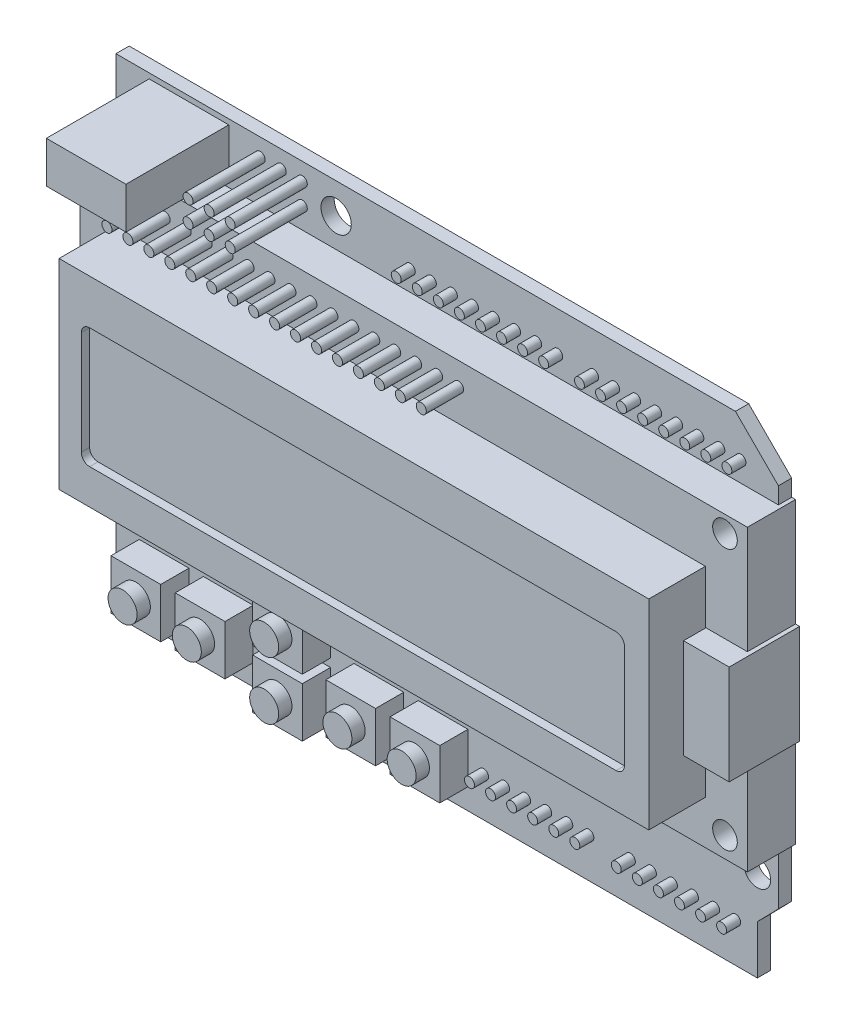
from build123d import *

# Parameters (mm, degrees)
SKETCH2_W            = 71.12
SKETCH2_H            = 24.13
BOSS_EXTRUDE1_DEPTH  = 12.63
SKETCH3_W            = 80.5
SKETCH3_H            = 36
SKETCH3_R            = 1.4859
BOSS_EXTRUDE2_DEPTH  = 5.8
SKETCH4_R            = 1.8288
SKETCH4_R_2          = 1.6
SKETCH4_R_3          = 1.4859
BOSS_EXTRUDE4_DEPTH  = 1.6
SKETCH5_R            = 1.75
BOSS_EXTRUDE5_DEPTH  = 6.6
SKETCH6_W            = 6
SKETCH6_H            = 6
BOSS_EXTRUDE6_DEPTH  = 5
SKETCH7_W            = 9.6
SKETCH7_H            = 5
BOSS_EXTRUDE7_DEPTH  = 14
SKETCH8_R            = 0.607588519
BOSS_EXTRUDE8_DEPTH  = 10.3
SKETCH9_R            = 0.6
BOSS_EXTRUDE9_DEPTH  = 3.3
SKETCH10_R           = 0.6
BOSS_EXTRUDE10_DEPTH = 10.3
SKETCH11_W           = 5.5
SKETCH11_H           = 12
BOSS_EXTRUDE11_DEPTH = 8.5
CUT_EXTRUDE1_DEPTH   = 1


with BuildPart() as part:
    # Sketch2 → Boss-Extrude1 (new body)
    with BuildSketch(Plane.XY):
        with Locations((39.392131734, 32.008259463)):
            Rectangle(SKETCH2_W, SKETCH2_H)
    extrude(amount=BOSS_EXTRUDE1_DEPTH)

    # Sketch3 → Boss-Extrude2 (add)
    with BuildSketch(Plane.XY):
        with Locations((39.764131734, 32.677259463)):
            Rectangle(SKETCH3_W, SKETCH3_H)
        with Locations((1.524412377, 48.661369793)):
            Circle(SKETCH3_R, mode=Mode.SUBTRACT)
        with Locations((1.524412377, 17.153759759)):
            Circle(SKETCH3_R, mode=Mode.SUBTRACT)
        with Locations((77.309031734, 17.153759463)):
            Circle(SKETCH3_R, mode=Mode.SUBTRACT)
        with Locations((77.309031734, 48.661369497)):
            Circle(SKETCH3_R, mode=Mode.SUBTRACT)
    extrude(amount=BOSS_EXTRUDE2_DEPTH)

    # Sketch4 → Boss-Extrude4 (add)
    with BuildSketch(Plane.XY):
        Polygon((-0.342397773, 57.8612), (74.3712, 57.8612), (79.5528, 52.6796), (79.5528, 8.4836), (77.0128, 5.880101811), (77.0128, 0), (-0.342397773, 0), align=None)
        with Locations((26.2128, 54.2036)):
            Circle(SKETCH4_R, mode=Mode.SUBTRACT)
        with Locations((77.0128, 11.0236)):
            Circle(SKETCH4_R_2, mode=Mode.SUBTRACT)
        with Locations((1.524412377, 48.661369793)):
            Circle(SKETCH4_R_3, mode=Mode.SUBTRACT)
        with Locations((1.524412377, 17.153759759)):
            Circle(SKETCH4_R_3, mode=Mode.SUBTRACT)
        with Locations((77.309031734, 17.153759463)):
            Circle(SKETCH4_R_3, mode=Mode.SUBTRACT)
        with Locations((77.309031734, 48.661369497)):
            Circle(SKETCH4_R_3, mode=Mode.SUBTRACT)
    extrude(amount=BOSS_EXTRUDE4_DEPTH)

    # Sketch5 → Boss-Extrude5 (add)
    with BuildSketch(Plane.XY):
        with Locations((5.460845243, 5.527822186)):
            Circle(SKETCH5_R)
        with Locations((39.115845243, 5.527822186)):
            Circle(SKETCH5_R)
        with Locations((31.368845243, 5.527822186)):
            Circle(SKETCH5_R)
        with Locations((22.537232927, 3.6978)):
            Circle(SKETCH5_R)
        with Locations((22.537232927, 10.6828)):
            Circle(SKETCH5_R)
        with Locations((13.207845243, 5.527822186)):
            Circle(SKETCH5_R)
    extrude(amount=BOSS_EXTRUDE5_DEPTH)

    # Sketch6 → Boss-Extrude6 (add)
    with BuildSketch(Plane.XY):
        with Locations((5.460845243, 5.527822186)):
            Rectangle(SKETCH6_W, SKETCH6_H)
        with Locations((13.207845243, 5.527822186)):
            Rectangle(SKETCH6_W, SKETCH6_H)
        with Locations((22.537232927, 10.6828)):
            Rectangle(SKETCH6_W, SKETCH6_H)
        with Locations((22.537232927, 3.6978)):
            Rectangle(SKETCH6_W, SKETCH6_H)
        with Locations((31.368845243, 5.527822186)):
            Rectangle(SKETCH6_W, SKETCH6_H)
        with Locations((39.115845243, 5.527822186)):
            Rectangle(SKETCH6_W, SKETCH6_H)
    extrude(amount=BOSS_EXTRUDE6_DEPTH)

    # Sketch7 → Boss-Extrude7 (add)
    with BuildSketch(Plane.XY):
        with Locations((8.4674, 54.729)):
            Rectangle(SKETCH7_W, SKETCH7_H)
    extrude(amount=BOSS_EXTRUDE7_DEPTH)

    # Sketch8 → Boss-Extrude8 (add)
    with BuildSketch(Plane.XY):
        with Locations((45.183190385, 47.927259463)):
            Circle(SKETCH8_R)
        with Locations((42.655890385, 47.927259463)):
            Circle(SKETCH8_R)
        with Locations((40.128590385, 47.927259463)):
            Circle(SKETCH8_R)
        with Locations((37.601290385, 47.927259463)):
            Circle(SKETCH8_R)
        with Locations((35.073990385, 47.927259463)):
            Circle(SKETCH8_R)
        with Locations((32.546690385, 47.927259463)):
            Circle(SKETCH8_R)
        with Locations((30.019390385, 47.927259463)):
            Circle(SKETCH8_R)
        with Locations((27.492090385, 47.927259463)):
            Circle(SKETCH8_R)
        with Locations((24.964790385, 47.927259463)):
            Circle(SKETCH8_R)
        with Locations((22.437490385, 47.927259463)):
            Circle(SKETCH8_R)
        with Locations((19.910190385, 47.927259463)):
            Circle(SKETCH8_R)
        with Locations((17.382890385, 47.927259463)):
            Circle(SKETCH8_R)
        with Locations((14.855590385, 47.927259463)):
            Circle(SKETCH8_R)
        with Locations((12.328290385, 47.927259463)):
            Circle(SKETCH8_R)
        with Locations((9.800990385, 47.927259463)):
            Circle(SKETCH8_R)
        with Locations((7.273690385, 47.927259463)):
            Circle(SKETCH8_R)
    extrude(amount=BOSS_EXTRUDE8_DEPTH)

    # Sketch9 → Boss-Extrude9 (add)
    with BuildSketch(Plane.XY):
        with Locations((74.399505323, 4.775685088)):
            Circle(SKETCH9_R)
        with Locations((71.859505323, 4.775685088)):
            Circle(SKETCH9_R)
        with Locations((69.319505323, 4.775685088)):
            Circle(SKETCH9_R)
        with Locations((66.779505323, 4.775685088)):
            Circle(SKETCH9_R)
        with Locations((64.239505323, 4.775685088)):
            Circle(SKETCH9_R)
        with Locations((61.699505323, 4.775685088)):
            Circle(SKETCH9_R)
        with Locations((56.696852257, 4.775685088)):
            Circle(SKETCH9_R)
        with Locations((54.156852257, 4.775685088)):
            Circle(SKETCH9_R)
        with Locations((51.616852257, 4.775685088)):
            Circle(SKETCH9_R)
        with Locations((49.076852257, 4.775685088)):
            Circle(SKETCH9_R)
        with Locations((46.536852257, 4.775685088)):
            Circle(SKETCH9_R)
        with Locations((43.996852257, 4.775685088)):
            Circle(SKETCH9_R)
        with Locations((75.037059203, 53.119768804)):
            Circle(SKETCH9_R)
        with Locations((72.497059203, 53.119768804)):
            Circle(SKETCH9_R)
        with Locations((69.957059203, 53.119768804)):
            Circle(SKETCH9_R)
        with Locations((67.417059203, 53.119768804)):
            Circle(SKETCH9_R)
        with Locations((64.877059203, 53.119768804)):
            Circle(SKETCH9_R)
        with Locations((62.337059203, 53.119768804)):
            Circle(SKETCH9_R)
        with Locations((59.797059203, 53.119768804)):
            Circle(SKETCH9_R)
        with Locations((57.257059203, 53.119768804)):
            Circle(SKETCH9_R)
        with Locations((52.939059203, 53.119768804)):
            Circle(SKETCH9_R)
        with Locations((50.399059203, 53.119768804)):
            Circle(SKETCH9_R)
        with Locations((47.859059203, 53.119768804)):
            Circle(SKETCH9_R)
        with Locations((45.319059203, 53.119768804)):
            Circle(SKETCH9_R)
        with Locations((42.779059203, 53.119768804)):
            Circle(SKETCH9_R)
        with Locations((40.239059203, 53.119768804)):
            Circle(SKETCH9_R)
        with Locations((37.699059203, 53.119768804)):
            Circle(SKETCH9_R)
        with Locations((35.159059203, 53.119768804)):
            Circle(SKETCH9_R)
    extrude(amount=BOSS_EXTRUDE9_DEPTH)

    # Sketch10 → Boss-Extrude10 (add)
    with BuildSketch(Plane.XY):
        with Locations((17.057745163, 53.220149318)):
            Circle(SKETCH10_R)
        with Locations((19.597745163, 53.220149318)):
            Circle(SKETCH10_R)
        with Locations((22.137745163, 53.220149318)):
            Circle(SKETCH10_R)
        with Locations((22.137745163, 55.760149318)):
            Circle(SKETCH10_R)
        with Locations((19.597745163, 55.760149318)):
            Circle(SKETCH10_R)
        with Locations((17.057745163, 55.760149318)):
            Circle(SKETCH10_R)
    extrude(amount=BOSS_EXTRUDE10_DEPTH)

    # Sketch11 → Boss-Extrude11 (add)
    with BuildSketch(Plane.XY):
        with Locations((77.764131734, 31.677259463)):
            Rectangle(SKETCH11_W, SKETCH11_H)
    extrude(amount=BOSS_EXTRUDE11_DEPTH)

    # Sketch12 → Cut-Extrude1 (cut)
    with BuildSketch(Plane.XY.offset(12.63)):
        with BuildLine():
            Line((72.014131734, 25.177259463), (72.014131734, 37.677259463))
            ThreePointArc((72.014131734, 37.677259463), (71.721238515, 38.384366244), (71.014131734, 38.677259463))
            Line((71.014131734, 38.677259463), (7.514131734, 38.677259463))
            ThreePointArc((7.514131734, 38.677259463), (6.807024953, 38.384366244), (6.514131734, 37.677259463))
            Line((6.514131734, 37.677259463), (6.514131734, 25.177259463))
            ThreePointArc((6.514131734, 25.177259463), (6.807024953, 24.470152682), (7.514131734, 24.177259463))
            Line((7.514131734, 24.177259463), (71.014131734, 24.177259463))
            ThreePointArc((71.014131734, 24.177259463), (71.721238515, 24.470152682), (72.014131734, 25.177259463))
        make_face()
    extrude(amount=-CUT_EXTRUDE1_DEPTH, mode=Mode.SUBTRACT)


solid = part.part
